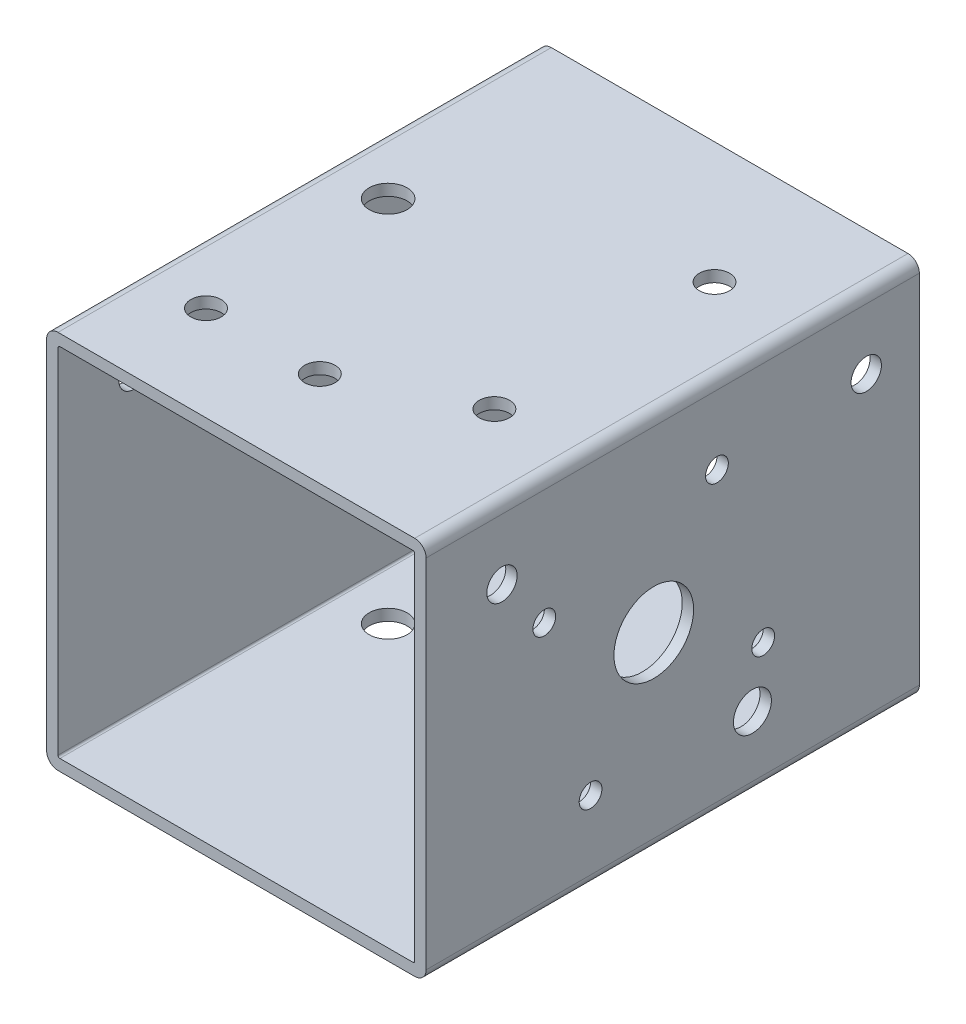
from build123d import *

# Parameters (mm, degrees)
SKETCH1_W                      = 100
SKETCH1_H                      = 100
SKETCH1_W_2                    = 94
SKETCH1_H_2                    = 94
EXTRUDE_THIN1_DEPTH            = 130
FILLET1_R                      = 0.5
FILLET2_R                      = 3
F_8_0_8_DIAMETER_HOLE2_D       = 8
F_8_0_8_DIAMETER_HOLE3_D       = 8
F_10_0_10_DIAMETER_HOLE1_D     = 10
F_10_0_10_DIAMETER_HOLE2_D     = 10
M8X1_25_TAPPED_HOLE1_D         = 6.8
M8X1_25_TAPPED_HOLE1_DEPTH     = 3
M8X1_25_TAPPED_HOLE2_D         = 6.8
M8X1_25_TAPPED_HOLE2_DEPTH     = 3
F_21_0_21_DIAMETER_HOLE1_D     = 21
F_21_0_21_DIAMETER_HOLE1_DEPTH = 3
F_6_0_6_DIAMETER_HOLE1_D       = 6
F_6_0_6_DIAMETER_HOLE1_DEPTH   = 3
F_8_0_8_DIAMETER_HOLE4_D       = 8
F_8_0_8_DIAMETER_HOLE4_DEPTH   = 3
SKETCH33_R                     = 4
CUT_EXTRUDE1_DEPTH             = 10


with BuildPart() as part:
    # Sketch1 → Extrude-Thin1 (new body)
    with BuildSketch(Plane.XY):
        Rectangle(SKETCH1_W, SKETCH1_H)
        Rectangle(SKETCH1_W_2, SKETCH1_H_2, mode=Mode.SUBTRACT)
    extrude(amount=EXTRUDE_THIN1_DEPTH)

    # Fillet1
    fillet1_edges = [part.edges().sort_by_distance(p)[0] for p in [
        (47, -47, 65),
        (47, 47, 65),
        (-47, 47, 65),
        (-47, -47, 65),
    ]]
    fillet(fillet1_edges, radius=FILLET1_R)

    # Fillet2
    fillet2_edges = [part.edges().sort_by_distance(p)[0] for p in [
        (50, -50, 65),
        (-50, -50, 65),
        (-50, 50, 65),
        (50, 50, 65),
    ]]
    fillet(fillet2_edges, radius=FILLET2_R)

    # Ø8.0 (8) Diameter Hole2 (through all)
    with Locations(Plane(origin=(0, 50, 0), x_dir=(1, 0, 0), z_dir=(0, 1, 0))):
        with Locations((28, -32), (28, -90)):
            Hole(F_8_0_8_DIAMETER_HOLE2_D / 2)

    # Ø8.0 (8) Diameter Hole3 (through all)
    with Locations(Plane(origin=(50, 0, 0), x_dir=(0, 0, -1), z_dir=(1, 0, 0))):
        with Locations((-14, 31), (-110, 31)):
            Hole(F_8_0_8_DIAMETER_HOLE3_D / 2)

    # Ø10.0 (10) Diameter Hole1 (through all)
    with Locations(Plane(origin=(0, 50, 0), x_dir=(1, 0, 0), z_dir=(0, 1, 0))):
        with Locations((-34, -56)):
            Hole(F_10_0_10_DIAMETER_HOLE1_D / 2)

    # Ø10.0 (10) Diameter Hole2 (through all)
    with Locations(Plane(origin=(50, 0, 0), x_dir=(0, 0, -1), z_dir=(1, 0, 0))):
        with Locations((-44, -31)):
            Hole(F_10_0_10_DIAMETER_HOLE2_D / 2)

    # M8x1.25 Tapped Hole1
    with Locations(Plane.ZY.offset(50)):
        with Locations((56, -15), (56, 35)):
            Hole(M8X1_25_TAPPED_HOLE1_D / 2, depth=M8X1_25_TAPPED_HOLE1_DEPTH)

    # M8x1.25 Tapped Hole2
    with Locations(Plane(origin=(0, -50, 0), x_dir=(-1, 0, 0), z_dir=(0, -1, 0))):
        with Locations((20, -44), (-35, -44)):
            Hole(M8X1_25_TAPPED_HOLE2_D / 2, depth=M8X1_25_TAPPED_HOLE2_DEPTH)

    # Ø21.0 (21) Diameter Hole1
    with Locations(Plane(origin=(50, 0, 0), x_dir=(0, 0, -1), z_dir=(1, 0, 0))):
        with Locations((-70, 0)):
            Hole(F_21_0_21_DIAMETER_HOLE1_D / 2, depth=F_21_0_21_DIAMETER_HOLE1_DEPTH)

    # Ø6.0 (6) Diameter Hole1
    with Locations(Plane(origin=(50, 0, 0), x_dir=(0, 0, -1), z_dir=(1, 0, 0))):
        with Locations((-41.157258279, -16.652364697), (-53.347635303, 28.842741721), (-98.842741721, 16.652364697), (-86.652364697, -28.842741721)):
            Hole(F_6_0_6_DIAMETER_HOLE1_D / 2, depth=F_6_0_6_DIAMETER_HOLE1_DEPTH)

    # Ø8.0 (8) Diameter Hole4
    with Locations(Plane(origin=(0, 50, 0), x_dir=(1, 0, 0), z_dir=(0, 1, 0))):
        with Locations((-3, -105)):
            Hole(F_8_0_8_DIAMETER_HOLE4_D / 2, depth=F_8_0_8_DIAMETER_HOLE4_DEPTH)

    # Sketch33 → Cut-Extrude1 (cut)
    with BuildSketch(Plane(origin=(0, 50, 0), x_dir=(1, 0, 0), z_dir=(0, 1, 0))):
        with Locations(Location((-33, -105, 0), (0, 0, 270))):
            Circle(SKETCH33_R)
    extrude(amount=-CUT_EXTRUDE1_DEPTH, mode=Mode.SUBTRACT)


solid = part.part
